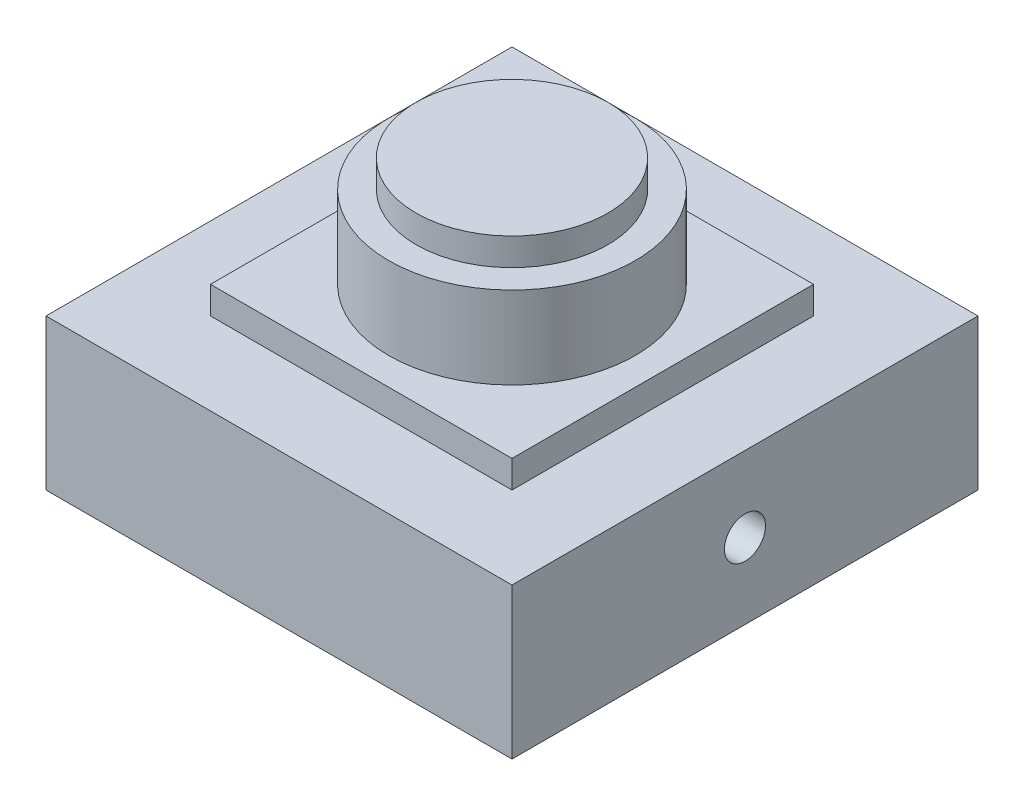
from build123d import *

# Parameters (mm, degrees)
SKETCH_1_W          = 34
SKETCH_1_H          = 34
EXTRUDE_1_DEPTH     = 11
SKETCH_2_W          = 22
SKETCH_2_H          = 22
EXTRUDE_2_DEPTH     = 2
SKETCH_3_R          = 9
EXTRUDE_3_DEPTH     = 6
SKETCH_4_R          = 7
EXTRUDE_4_DEPTH     = 2
SKETCH_5_R          = 1.5
CUT_EXTRUDE_1_DEPTH = 34


with BuildPart() as part:
    # 草图1 → 凸台-拉伸1 (new body)
    with BuildSketch(Plane(origin=(0, 0, 0), x_dir=(1, 0, 0), z_dir=(0, 1, 0))):
        Rectangle(SKETCH_1_W, SKETCH_1_H)
    extrude(amount=EXTRUDE_1_DEPTH)

    # 草图2 → 凸台-拉伸2 (add)
    with BuildSketch(Plane(origin=(0, 11, 0), x_dir=(1, 0, 0), z_dir=(0, 1, 0))):
        Rectangle(SKETCH_2_W, SKETCH_2_H)
    extrude(amount=EXTRUDE_2_DEPTH)

    # 草图3 → 凸台-拉伸3 (add)
    with BuildSketch(Plane(origin=(0, 13, 0), x_dir=(1, 0, 0), z_dir=(0, 1, 0))):
        with Locations(Location((0, 0, 0), (0, 0, 270))):
            Circle(SKETCH_3_R)
    extrude(amount=EXTRUDE_3_DEPTH)

    # 草图4 → 凸台-拉伸4 (add)
    with BuildSketch(Plane(origin=(0, 19, 0), x_dir=(1, 0, 0), z_dir=(0, 1, 0))):
        with Locations(Location((0, 0, 0), (0, 0, 270))):
            Circle(SKETCH_4_R)
    extrude(amount=EXTRUDE_4_DEPTH)

    # 草图5 → 切除-拉伸1 (cut)
    with BuildSketch(Plane(origin=(17, 0, 0), x_dir=(0, 0, -1), z_dir=(1, 0, 0))):
        with Locations((0, 5.5)):
            Circle(SKETCH_5_R)
    extrude(amount=-CUT_EXTRUDE_1_DEPTH, mode=Mode.SUBTRACT)


solid = part.part
